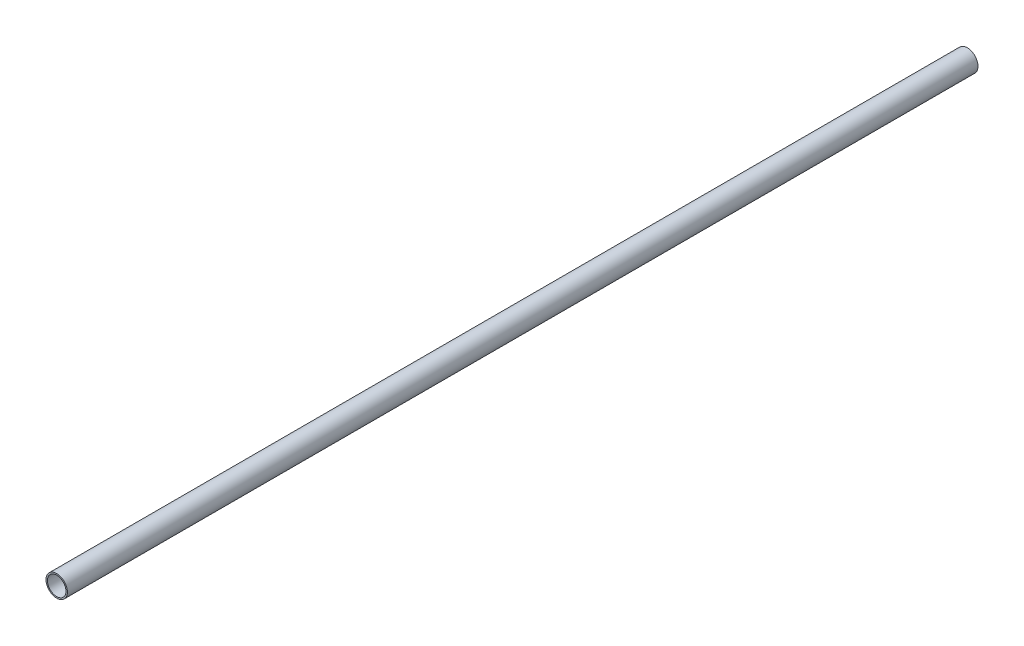
from build123d import *

# Parameters (mm, degrees)
SKETCH1_R           = 11.938
SKETCH1_R_2         = 10.3505
BOSS_EXTRUDE1_DEPTH = 1016


with BuildPart() as part:
    # Sketch1 → Boss-Extrude1 (new body)
    with BuildSketch(Plane.XY):
        Circle(SKETCH1_R)
        Circle(SKETCH1_R_2, mode=Mode.SUBTRACT)
    extrude(amount=-BOSS_EXTRUDE1_DEPTH)


solid = part.part
